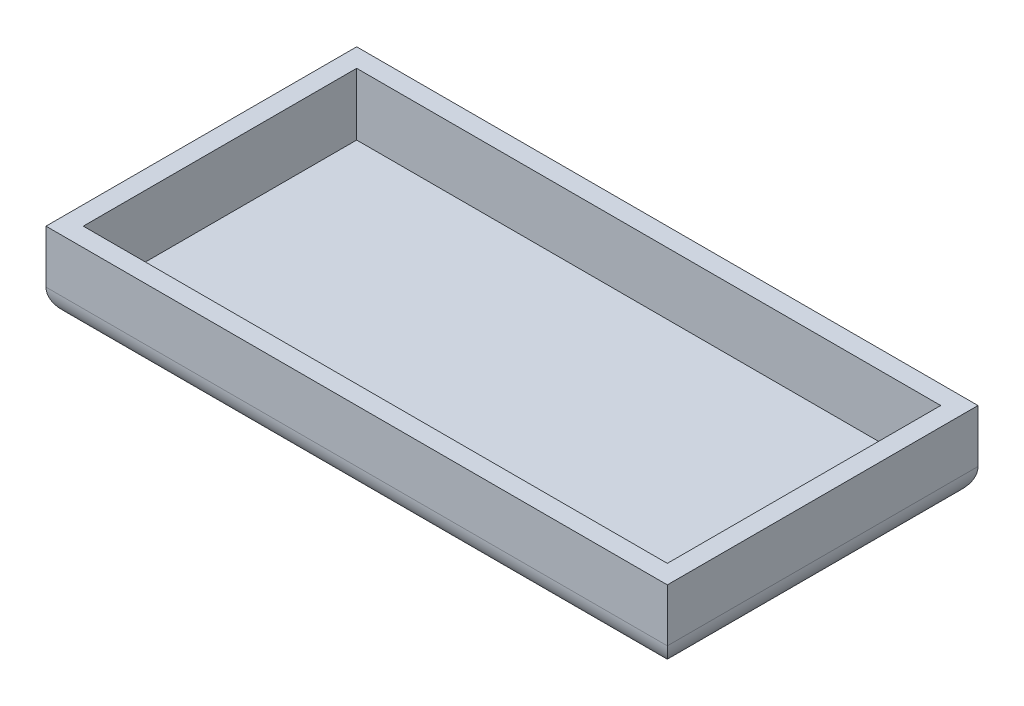
from build123d import *

# Parameters (mm, degrees)
SKETCH1_W           = 4000
SKETCH1_H           = 2000
BOSS_EXTRUDE2_DEPTH = 120
SKETCH2_W           = 4000
SKETCH2_H           = 2000
SKETCH2_W_2         = 3760
SKETCH2_H_2         = 1760
BOSS_EXTRUDE3_DEPTH = 400
FILLET1_R           = 180


with BuildPart() as part:
    # Sketch1 → Boss-Extrude2 (new body)
    with BuildSketch(Plane(origin=(0, 0, 0), x_dir=(1, 0, 0), z_dir=(0, 1, 0))):
        Rectangle(SKETCH1_W, SKETCH1_H)
    extrude(amount=BOSS_EXTRUDE2_DEPTH)

    # Sketch2 → Boss-Extrude3 (add)
    with BuildSketch(Plane(origin=(0, 120, 0), x_dir=(1, 0, 0), z_dir=(0, 1, 0))):
        Rectangle(SKETCH2_W, SKETCH2_H)
        Rectangle(SKETCH2_W_2, SKETCH2_H_2, mode=Mode.SUBTRACT)
    extrude(amount=BOSS_EXTRUDE3_DEPTH)

    # Fillet1
    fillet1_edges = [part.edges().sort_by_distance(p)[0] for p in [
        (0, 0, 1000),
        (-2000, 0, 0),
        (0, 0, -1000),
        (2000, 0, 0),
    ]]
    fillet(fillet1_edges, radius=FILLET1_R)


solid = part.part
